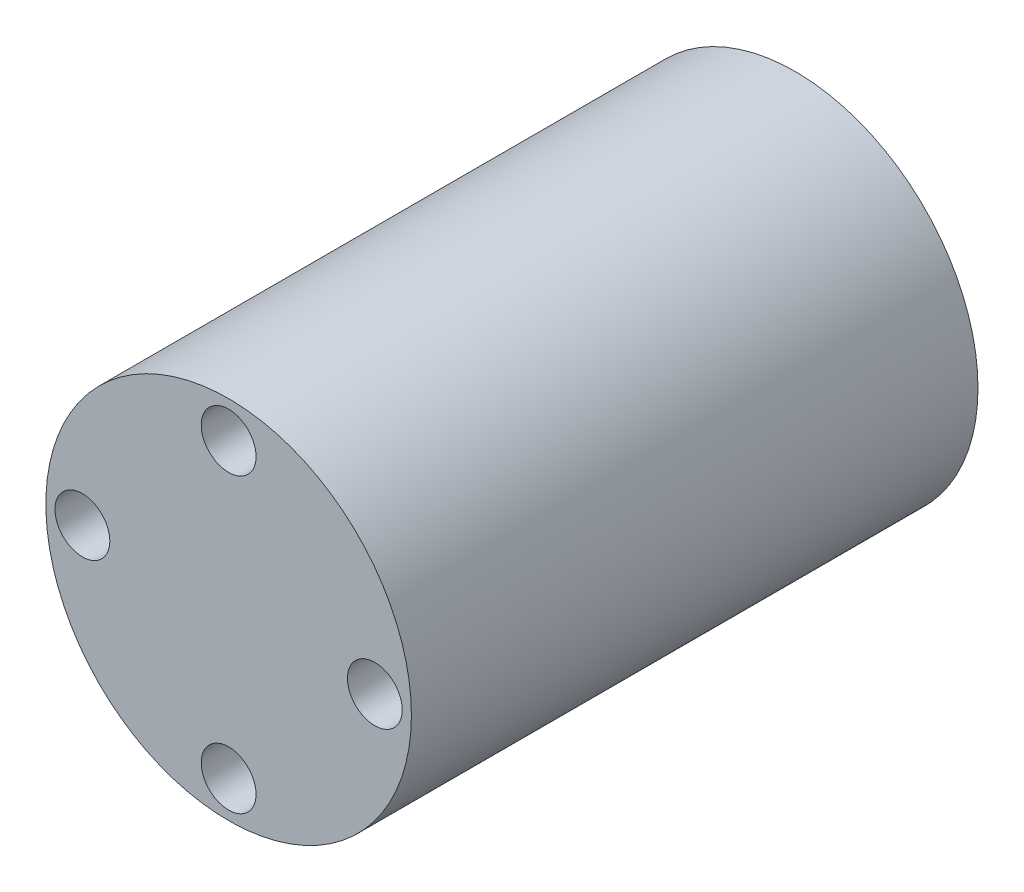
from build123d import *

# Parameters (mm, degrees)
SKIZZE1_R                       = 10
SKIZZE1_R_2                     = 1.5
AUFSATZ_LINEAR_AUSTRAGEN1_DEPTH = 31


with BuildPart() as part:
    # Skizze1 → Aufsatz-Linear austragen1 (new body)
    with BuildSketch(Plane.XY):
        Circle(SKIZZE1_R)
        with Locations((8, 0)):
            Circle(SKIZZE1_R_2, mode=Mode.SUBTRACT)
        with Locations((0, -8)):
            Circle(SKIZZE1_R_2, mode=Mode.SUBTRACT)
        with Locations((-8, 0)):
            Circle(SKIZZE1_R_2, mode=Mode.SUBTRACT)
        with Locations((0, 8)):
            Circle(SKIZZE1_R_2, mode=Mode.SUBTRACT)
    extrude(amount=AUFSATZ_LINEAR_AUSTRAGEN1_DEPTH)


solid = part.part
